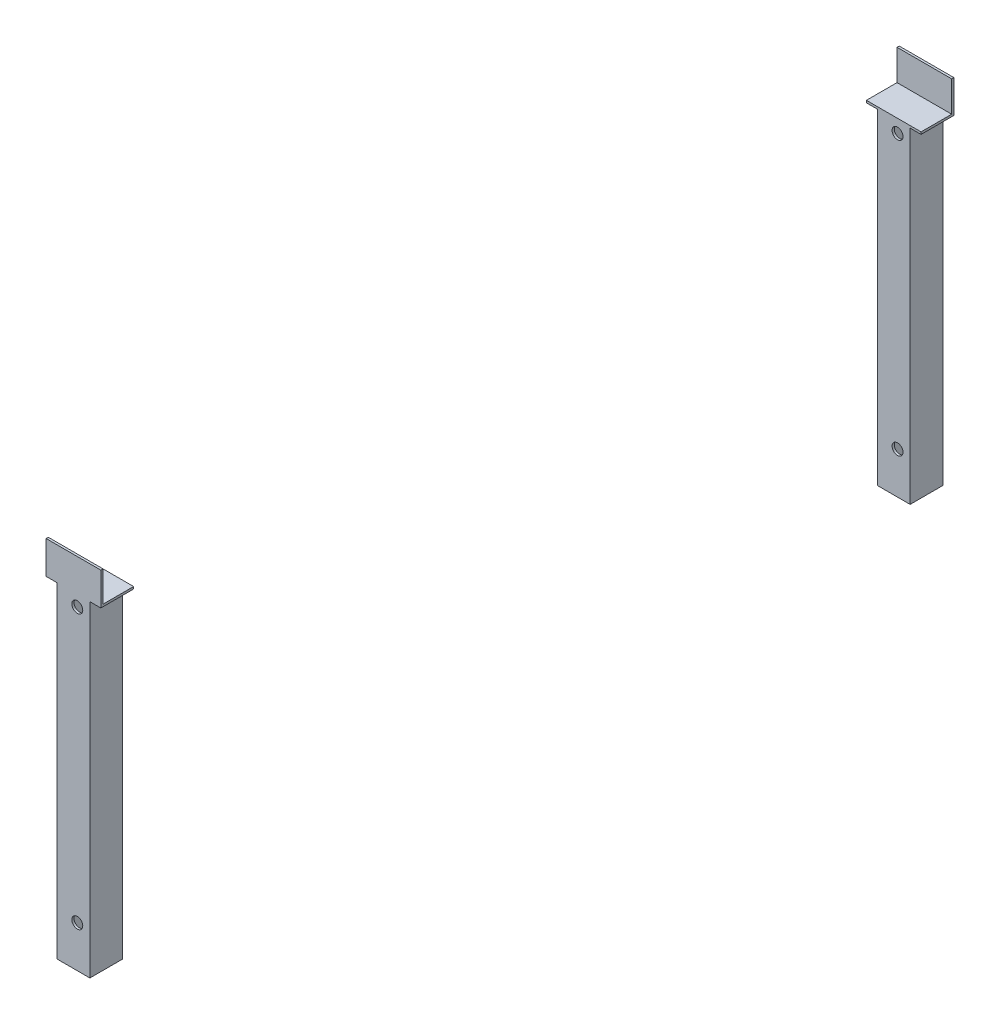
from build123d import *

# Parameters (mm, degrees)
SKETCH1_W           = 30
SKETCH1_H           = 30
BOSS_EXTRUDE1_DEPTH = 298
SHELL1_T            = -2
BOSS_EXTRUDE2_DEPTH = 2
BOSS_EXTRUDE4_DEPTH = 2
SKETCH5_R           = 5
CUT_EXTRUDE1_DEPTH  = 331.316514876


with BuildPart() as part:
    # Sketch1 → Boss-Extrude1 (new body)
    with BuildSketch(Plane(origin=(0, 0, 0), x_dir=(1, 0, 0), z_dir=(0, 1, 0))):
        Rectangle(SKETCH1_W, SKETCH1_H)
    extrude(amount=BOSS_EXTRUDE1_DEPTH)

    # Shell1
    shell1_openings = [part.faces().sort_by_distance(p)[0] for p in [
        (0, 0, 0),
    ]]
    offset(amount=SHELL1_T, openings=shell1_openings, kind=Kind.INTERSECTION)

    # Sketch2 → Boss-Extrude2 (add)
    with BuildSketch(Plane.XY.offset(15)):
        Polygon((-15, 298), (-25, 298), (-25, 328), (25, 328), (25, 298), (15, 298), align=None)
    extrude(amount=-BOSS_EXTRUDE2_DEPTH)

    # Sketch3 → Boss-Extrude4 (add)
    with BuildSketch(Plane(origin=(0, 298, 0), x_dir=(1, 0, 0), z_dir=(0, 1, 0))):
        Polygon((-15, -13), (-25, -13), (-25, 15), (25, 15), (25, -13), align=None)
    extrude(amount=BOSS_EXTRUDE4_DEPTH)

    # Sketch5 → Cut-Extrude1 (cut, through all)
    with BuildSketch(Plane.XY.offset(15)):
        with Locations((3.5, 288)):
            Circle(SKETCH5_R)
        with Locations((3.5, 38)):
            Circle(SKETCH5_R)
    extrude(amount=-CUT_EXTRUDE1_DEPTH, mode=Mode.SUBTRACT)


with BuildPart() as body_2:
    # Mirror2: mirrored copy
    add(part.part.mirror(Plane.XY.offset(-375)))


solid = Compound([part.part, body_2.part])
